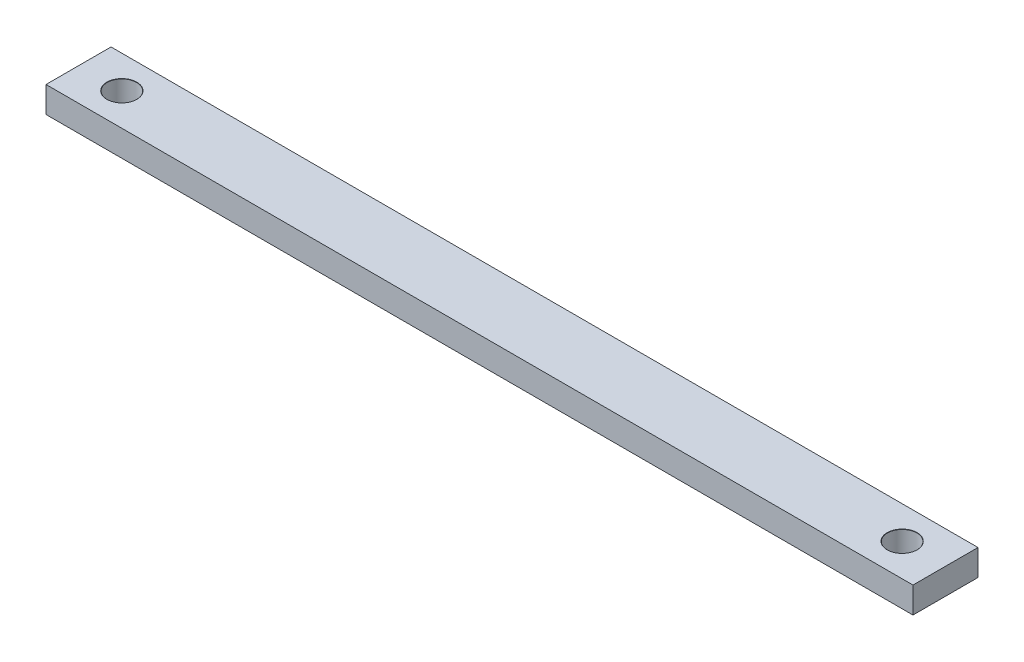
from build123d import *

# Parameters (mm, degrees)
SKETCH1_W                      = 100
SKETCH1_H                      = 7.5
BOSS_EXTRUDE1_DEPTH            = 3
M3_CLEARANCE_HOLE1_D           = 3.4
M3_CLEARANCE_HOLE1_CSINK_D     = 3.45
M3_CLEARANCE_HOLE1_CSINK_ANGLE = 90


with BuildPart() as part:
    # Sketch1 → Boss-Extrude1 (new body)
    with BuildSketch(Plane(origin=(0, 0, 0), x_dir=(1, 0, 0), z_dir=(0, 1, 0))):
        Rectangle(SKETCH1_W, SKETCH1_H)
    extrude(amount=BOSS_EXTRUDE1_DEPTH)

    # M3 Clearance Hole1 (through all)
    with Locations(Plane(origin=(0, 3, 0), x_dir=(1, 0, 0), z_dir=(0, 1, 0))):
        with Locations((-45, 0), (45, 0)):
            CounterSinkHole(M3_CLEARANCE_HOLE1_D / 2, M3_CLEARANCE_HOLE1_CSINK_D / 2, counter_sink_angle=M3_CLEARANCE_HOLE1_CSINK_ANGLE)


solid = part.part
